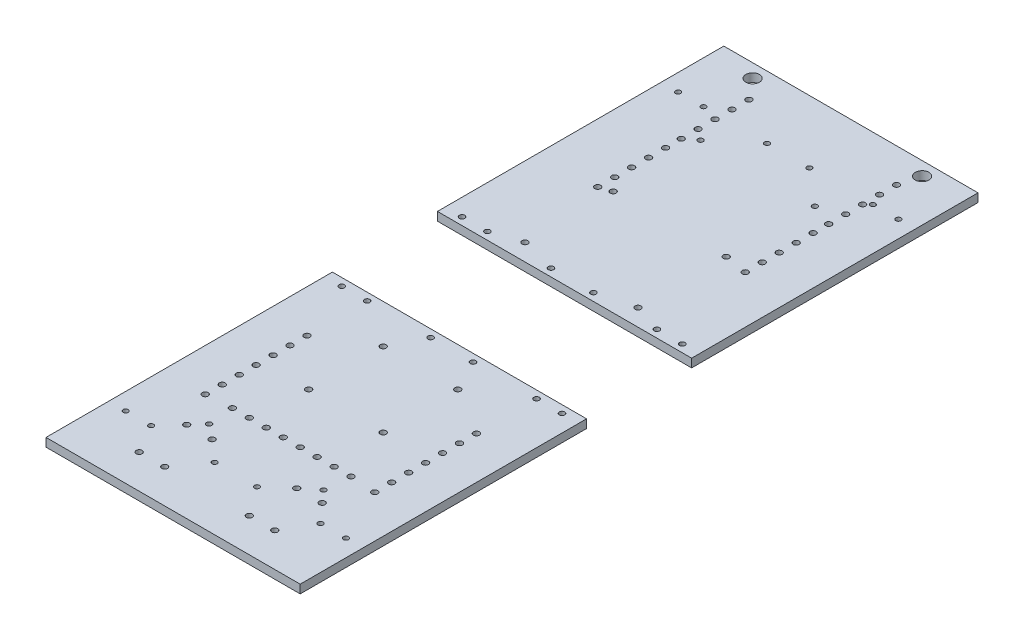
from build123d import *

# Parameters (mm, degrees)
SKETCH_1_W          = 150
SKETCH_1_H          = 400
SKETCH_1_R          = 1.55
SKETCH_1_R_2        = 1.5
EXTRUDE_1_DEPTH     = 5
SKETCH_2_R          = 1.75
SKETCH_2_R_2        = 4
SKETCH_2_R_3        = 1.6
SKETCH_2_W          = 150
SKETCH_2_H          = 62
CUT_EXTRUDE_1_DEPTH = 214.658606192


with BuildPart() as part:
    # 草图1 → 凸台-拉伸1 (new body)
    with BuildSketch(Plane(origin=(0, 0, 0), x_dir=(1, 0, 0), z_dir=(0, 1, 0))):
        Rectangle(SKETCH_1_W, SKETCH_1_H)
        with Locations(Location((-41.75, 0, 0), (0, 0, 270))):
            Circle(SKETCH_1_R, mode=Mode.SUBTRACT)
        with Locations(Location((41.75, 0, 0), (0, 0, 90))):
            Circle(SKETCH_1_R, mode=Mode.SUBTRACT)
        with Locations(Location((-33.75, -145, 0), (0, 0, 270))):
            Circle(SKETCH_1_R, mode=Mode.SUBTRACT)
        with Locations(Location((33.75, -145, 0), (0, 0, 90))):
            Circle(SKETCH_1_R, mode=Mode.SUBTRACT)
        with Locations(Location((-33.75, 145, 0), (0, 0, 90))):
            Circle(SKETCH_1_R, mode=Mode.SUBTRACT)
        with Locations(Location((33.75, 145, 0), (0, 0, 270))):
            Circle(SKETCH_1_R, mode=Mode.SUBTRACT)
        with Locations(Location((65, -163, 0), (0, 0, 270))):
            Circle(SKETCH_1_R_2, mode=Mode.SUBTRACT)
        with Locations(Location((50, -163, 0), (0, 0, 270))):
            Circle(SKETCH_1_R_2, mode=Mode.SUBTRACT)
        with Locations(Location((12.5, -163, 0), (0, 0, 270))):
            Circle(SKETCH_1_R_2, mode=Mode.SUBTRACT)
        with Locations(Location((-65, -163, 0), (0, 0, 90))):
            Circle(SKETCH_1_R_2, mode=Mode.SUBTRACT)
        with Locations(Location((-50, -163, 0), (0, 0, 90))):
            Circle(SKETCH_1_R_2, mode=Mode.SUBTRACT)
        with Locations(Location((-12.5, -163, 0), (0, 0, 90))):
            Circle(SKETCH_1_R_2, mode=Mode.SUBTRACT)
        with Locations(Location((65, 163, 0), (0, 0, 90))):
            Circle(SKETCH_1_R_2, mode=Mode.SUBTRACT)
        with Locations(Location((50, 163, 0), (0, 0, 90))):
            Circle(SKETCH_1_R_2, mode=Mode.SUBTRACT)
        with Locations(Location((12.5, 163, 0), (0, 0, 90))):
            Circle(SKETCH_1_R_2, mode=Mode.SUBTRACT)
        with Locations(Location((-12.5, 163, 0), (0, 0, 270))):
            Circle(SKETCH_1_R_2, mode=Mode.SUBTRACT)
        with Locations(Location((-50, 163, 0), (0, 0, 270))):
            Circle(SKETCH_1_R_2, mode=Mode.SUBTRACT)
        with Locations(Location((-65, 163, 0), (0, 0, 270))):
            Circle(SKETCH_1_R_2, mode=Mode.SUBTRACT)
    extrude(amount=EXTRUDE_1_DEPTH)

    # 草图2 → 切除-拉伸1 (cut, through all)
    with BuildSketch(Plane(origin=(0, 5, 0), x_dir=(1, 0, 0), z_dir=(0, 1, 0))):
        with Locations(Location((-40.19, 160, 0), (0, 0, 270))):
            Circle(SKETCH_2_R)
        with Locations(Location((46.89, 160, 0), (0, 0, 90))):
            Circle(SKETCH_2_R)
        with Locations(Location((46.89, 110.79, 0), (0, 0, 270))):
            Circle(SKETCH_2_R)
        with Locations(Location((-40.19, 110.79, 0), (0, 0, 90))):
            Circle(SKETCH_2_R)
        with Locations(Location((-40.19, 170, 0), (0, 0, 270))):
            Circle(SKETCH_2_R)
        with Locations(Location((-40.19, 120.79, 0), (0, 0, 90))):
            Circle(SKETCH_2_R)
        with Locations(Location((46.89, 170, 0), (0, 0, 90))):
            Circle(SKETCH_2_R)
        with Locations(Location((46.89, 120.79, 0), (0, 0, 270))):
            Circle(SKETCH_2_R)
        with Locations(Location((-40.19, 180, 0), (0, 0, 270))):
            Circle(SKETCH_2_R)
        with Locations(Location((-40.19, 130.79, 0), (0, 0, 90))):
            Circle(SKETCH_2_R)
        with Locations(Location((46.89, 180, 0), (0, 0, 90))):
            Circle(SKETCH_2_R)
        with Locations(Location((46.89, 130.79, 0), (0, 0, 270))):
            Circle(SKETCH_2_R)
        with Locations(Location((-33.35, 93.05, 0), (0, 0, 270))):
            Circle(SKETCH_2_R)
        with Locations(Location((-33.35, 41, 0), (0, 0, 90))):
            Circle(SKETCH_2_R)
        with Locations(Location((33.35, 41, 0), (0, 0, 270))):
            Circle(SKETCH_2_R)
        with Locations(Location((33.35, 93.05, 0), (0, 0, 90))):
            Circle(SKETCH_2_R)
        with Locations(Location((-40.19, 100.79, 0), (0, 0, 90))):
            Circle(SKETCH_2_R)
        with Locations(Location((46.89, 100.79, 0), (0, 0, 270))):
            Circle(SKETCH_2_R)
        with Locations(Location((-40.19, 150, 0), (0, 0, 270))):
            Circle(SKETCH_2_R)
        with Locations(Location((46.89, 150, 0), (0, 0, 90))):
            Circle(SKETCH_2_R)
        with Locations(Location((-40.19, 90.79, 0), (0, 0, 90))):
            Circle(SKETCH_2_R)
        with Locations(Location((46.89, 90.79, 0), (0, 0, 270))):
            Circle(SKETCH_2_R)
        with Locations(Location((-40.19, 140, 0), (0, 0, 270))):
            Circle(SKETCH_2_R)
        with Locations(Location((46.89, 140, 0), (0, 0, 90))):
            Circle(SKETCH_2_R)
        with Locations(Location((-40, -152, 0), (0, 0, 270))):
            Circle(SKETCH_2_R)
        with Locations(Location((-25, -152, 0), (0, 0, 90))):
            Circle(SKETCH_2_R)
        with Locations(Location((-25, -180, 0), (0, 0, 270))):
            Circle(SKETCH_2_R)
        with Locations(Location((-40, -180, 0), (0, 0, 90))):
            Circle(SKETCH_2_R)
        with Locations(Location((25, -152, 0), (0, 0, 270))):
            Circle(SKETCH_2_R)
        with Locations(Location((25, -180, 0), (0, 0, 90))):
            Circle(SKETCH_2_R)
        with Locations(Location((40, -180, 0), (0, 0, 270))):
            Circle(SKETCH_2_R)
        with Locations(Location((40, -152, 0), (0, 0, 90))):
            Circle(SKETCH_2_R)
        with Locations(Location((-22, -54, 0), (0, 0, 270))):
            Circle(SKETCH_2_R)
        with Locations(Location((22, -54, 0), (0, 0, 90))):
            Circle(SKETCH_2_R)
        with Locations(Location((22, -98, 0), (0, 0, 270))):
            Circle(SKETCH_2_R)
        with Locations(Location((-22, -98, 0), (0, 0, 90))):
            Circle(SKETCH_2_R)
        with Locations(Location((-50, -71, 0), (0, 0, 270))):
            Circle(SKETCH_2_R)
        with Locations(Location((50, -71, 0), (0, 0, 90))):
            Circle(SKETCH_2_R)
        with Locations(Location((50, -81, 0), (0, 0, 90))):
            Circle(SKETCH_2_R)
        with Locations(Location((-50, -81, 0), (0, 0, 270))):
            Circle(SKETCH_2_R)
        with Locations(Location((50, -91, 0), (0, 0, 90))):
            Circle(SKETCH_2_R)
        with Locations(Location((-50, -91, 0), (0, 0, 270))):
            Circle(SKETCH_2_R)
        with Locations(Location((50, -101, 0), (0, 0, 90))):
            Circle(SKETCH_2_R)
        with Locations(Location((-50, -101, 0), (0, 0, 270))):
            Circle(SKETCH_2_R)
        with Locations(Location((50, -111, 0), (0, 0, 90))):
            Circle(SKETCH_2_R)
        with Locations(Location((-50, -111, 0), (0, 0, 270))):
            Circle(SKETCH_2_R)
        with Locations(Location((50, -121, 0), (0, 0, 90))):
            Circle(SKETCH_2_R)
        with Locations(Location((-50, -121, 0), (0, 0, 270))):
            Circle(SKETCH_2_R)
        with Locations(Location((50, -131, 0), (0, 0, 90))):
            Circle(SKETCH_2_R)
        with Locations(Location((-50, -131, 0), (0, 0, 270))):
            Circle(SKETCH_2_R)
        with Locations(Location((-5, -130, 0), (0, 0, 270))):
            Circle(SKETCH_2_R)
        with Locations(Location((5, -130, 0), (0, 0, 90))):
            Circle(SKETCH_2_R)
        with Locations(Location((-15, -130, 0), (0, 0, 270))):
            Circle(SKETCH_2_R)
        with Locations(Location((-25, -130, 0), (0, 0, 270))):
            Circle(SKETCH_2_R)
        with Locations(Location((-35, -130, 0), (0, 0, 270))):
            Circle(SKETCH_2_R)
        with Locations(Location((15, -130, 0), (0, 0, 90))):
            Circle(SKETCH_2_R)
        with Locations(Location((25, -130, 0), (0, 0, 90))):
            Circle(SKETCH_2_R)
        with Locations(Location((35, -130, 0), (0, 0, 90))):
            Circle(SKETCH_2_R)
        with Locations(Location((-50, 192, 0), (0, 0, 270))):
            Circle(SKETCH_2_R_2)
        with Locations(Location((50, 192, 0), (0, 0, 90))):
            Circle(SKETCH_2_R_2)
        with Locations(Location((65, 35.5, 0), (0, 0, 270))):
            Circle(SKETCH_2_R_3)
        with Locations(Location((50, 35.5, 0), (0, 0, 270))):
            Circle(SKETCH_2_R_3)
        with Locations(Location((12.5, 35.5, 0), (0, 0, 270))):
            Circle(SKETCH_2_R_3)
        with Locations(Location((-65, 35.5, 0), (0, 0, 90))):
            Circle(SKETCH_2_R_3)
        with Locations(Location((-50, 35.5, 0), (0, 0, 90))):
            Circle(SKETCH_2_R_3)
        with Locations(Location((-12.5, 35.5, 0), (0, 0, 90))):
            Circle(SKETCH_2_R_3)
        with Locations(Location((65, -35.5, 0), (0, 0, 90))):
            Circle(SKETCH_2_R_3)
        with Locations(Location((50, -35.5, 0), (0, 0, 90))):
            Circle(SKETCH_2_R_3)
        with Locations(Location((12.5, -35.5, 0), (0, 0, 90))):
            Circle(SKETCH_2_R_3)
        with Locations(Location((-12.5, -35.5, 0), (0, 0, 270))):
            Circle(SKETCH_2_R_3)
        with Locations(Location((-50, -35.5, 0), (0, 0, 270))):
            Circle(SKETCH_2_R_3)
        with Locations(Location((-65, -35.5, 0), (0, 0, 270))):
            Circle(SKETCH_2_R_3)
        Rectangle(SKETCH_2_W, SKETCH_2_H)
    extrude(amount=-CUT_EXTRUDE_1_DEPTH, mode=Mode.SUBTRACT)


with BuildPart() as cut_extrude_1_piece_1:
    # of the separate pieces the step leaves, piece 1, a body of its own (cut_extrude_1_pieces)
    add(part.part.solids().sort_by_distance((-75, 0, 200))[0])


with BuildPart() as cut_extrude_1_piece_2:
    # of the separate pieces the step leaves, piece 2, a body of its own (cut_extrude_1_pieces)
    add(part.part.solids().sort_by_distance((-75, 0, -200))[0])


solid = Compound([cut_extrude_1_piece_1.part, cut_extrude_1_piece_2.part])
